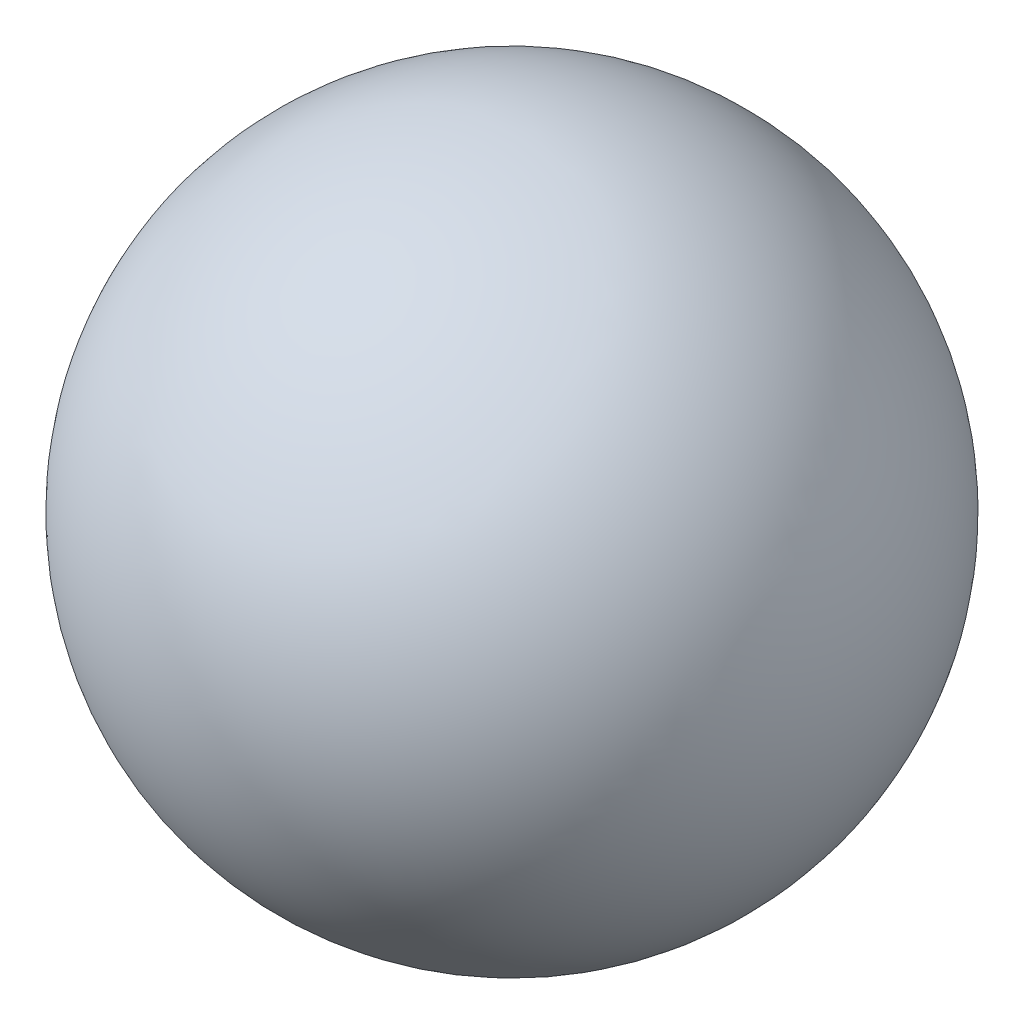
from build123d import *


with BuildPart() as part:
    # Sketch1 → Revolve1 (revolve)
    with BuildSketch(Plane.XY):
        with BuildLine():
            Line((-60, 0), (60, 0))
            ThreePointArc((60, 0), (0, 60), (-60, 0))
        make_face()
    revolve(axis=Axis((-60, 0, 0), (1, 0, 0)))


solid = part.part
